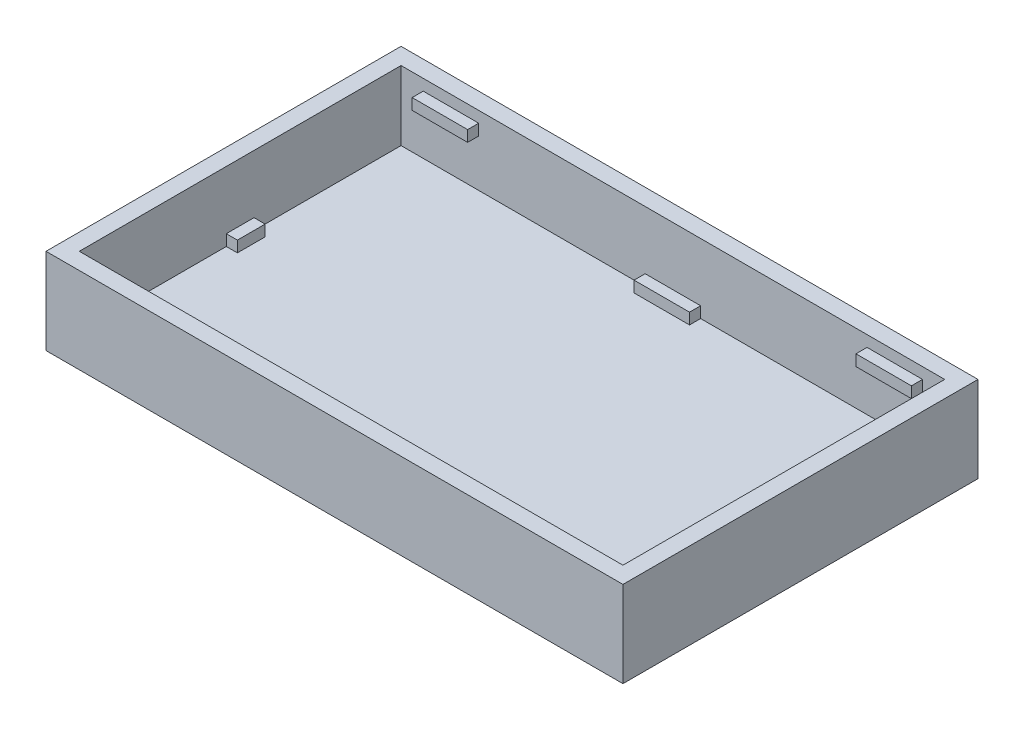
from build123d import *

# Parameters (mm, degrees)
SKETCH_1_W      = 104
SKETCH_1_H      = 64
SKETCH_1_W_2    = 98
SKETCH_1_H_2    = 58
EXTRUDE_1_DEPTH = 2
SKETCH_1_3_W    = 104
SKETCH_1_3_H    = 64
EXTRUDE_2_DEPTH = 3
SKETCH_2_W      = 2
SKETCH_2_H      = 5
SKETCH_2_W_2    = 10
SKETCH_2_H_2    = 2
EXTRUDE_3_DEPTH = 2
EXTRUDE_START   = 2
SKETCH_1_4_W    = 104
SKETCH_1_4_H    = 64
SKETCH_1_4_W_2  = 98
SKETCH_1_4_H_2  = 58
EXTRUDE_4_DEPTH = 8.5
SKETCH_3_W      = 10
SKETCH_3_H      = 2
EXTRUDE_5_DEPTH = 2
EXTRUDE_START_2 = 10.5
SKETCH_1_5_W    = 104
SKETCH_1_5_H    = 64
SKETCH_1_5_W_2  = 98
SKETCH_1_5_H_2  = 58
EXTRUDE_6_DEPTH = 2


with BuildPart() as part:
    # 草图1 → 凸台-拉伸1 (new body)
    with BuildSketch(Plane(origin=(0, 0, 0), x_dir=(1, 0, 0), z_dir=(0, 1, 0))):
        Rectangle(SKETCH_1_W, SKETCH_1_H)
        Rectangle(SKETCH_1_W_2, SKETCH_1_H_2, mode=Mode.SUBTRACT)
    extrude(amount=EXTRUDE_1_DEPTH)

    # 草图1<3> → 凸台-拉伸2 (add)
    with BuildSketch(Plane(origin=(0, 0, 0), x_dir=(1, 0, 0), z_dir=(0, 1, 0))):
        Rectangle(SKETCH_1_3_W, SKETCH_1_3_H)
    extrude(amount=-EXTRUDE_2_DEPTH)

    # 草图2 → 凸台-拉伸3 (add)
    with BuildSketch(Plane(origin=(0, 0, 0), x_dir=(1, 0, 0), z_dir=(0, 1, 0))):
        with Locations((-48, 0)):
            Rectangle(SKETCH_2_W, SKETCH_2_H)
        with Locations((48, 0)):
            Rectangle(SKETCH_2_W, SKETCH_2_H)
        with Locations((0, 28)):
            Rectangle(SKETCH_2_W_2, SKETCH_2_H_2)
        with Locations((0, -28)):
            Rectangle(SKETCH_2_W_2, SKETCH_2_H_2)
    extrude(amount=EXTRUDE_3_DEPTH)

    # 草图1<4> → 凸台-拉伸4 (add)
    with BuildSketch(Plane(origin=(0, 0, 0), x_dir=(1, 0, 0), z_dir=(0, 1, 0)).offset(EXTRUDE_START)):
        Rectangle(SKETCH_1_4_W, SKETCH_1_4_H)
        Rectangle(SKETCH_1_4_W_2, SKETCH_1_4_H_2, mode=Mode.SUBTRACT)
    extrude(amount=EXTRUDE_4_DEPTH)

    # 草图3 → 凸台-拉伸5 (add)
    with BuildSketch(Plane(origin=(0, 10.5, 0), x_dir=(1, 0, 0), z_dir=(0, 1, 0))):
        with Locations((40, -28)):
            Rectangle(SKETCH_3_W, SKETCH_3_H)
        with Locations((-40, -28)):
            Rectangle(SKETCH_3_W, SKETCH_3_H)
        with Locations((40, 28)):
            Rectangle(SKETCH_3_W, SKETCH_3_H)
        with Locations((-40, 28)):
            Rectangle(SKETCH_3_W, SKETCH_3_H)
    extrude(amount=-EXTRUDE_5_DEPTH)

    # 草图1<5> → 凸台-拉伸6 (add)
    with BuildSketch(Plane(origin=(0, 0, 0), x_dir=(1, 0, 0), z_dir=(0, 1, 0)).offset(EXTRUDE_START_2)):
        Rectangle(SKETCH_1_5_W, SKETCH_1_5_H)
        Rectangle(SKETCH_1_5_W_2, SKETCH_1_5_H_2, mode=Mode.SUBTRACT)
    extrude(amount=EXTRUDE_6_DEPTH)


solid = part.part
